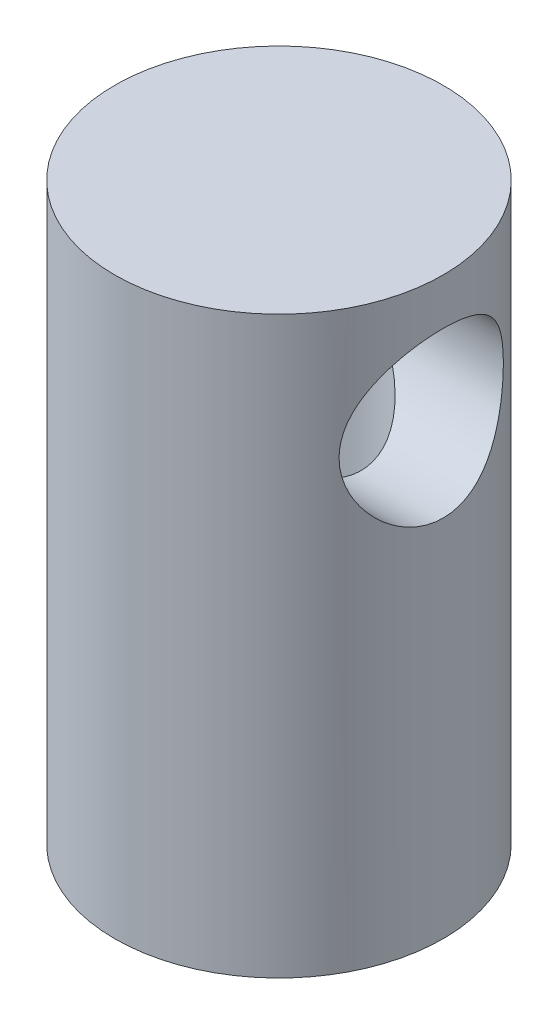
from build123d import *

# Parameters (mm, degrees)
SKETCH_1_R               = 6
EXTRUDE_2_DEPTH          = 21
SKETCH_2_R               = 3
CUT_EXTRUDE_1_DEPTH      = 15
CUT_EXTRUDE_2_DEPTH      = 10
CUT_EXTRUDE_2_DEPTH_BACK = 10
SKETCH_3_R               = 3


with BuildPart() as part:
    # 草图1 → 凸台-拉伸2 (new body)
    with BuildSketch(Plane(origin=(0, 0, 0), x_dir=(1, 0, 0), z_dir=(0, 1, 0))):
        Circle(SKETCH_1_R)
    extrude(amount=EXTRUDE_2_DEPTH)

    # 草图2 → 切除-拉伸1 (cut)
    with BuildSketch(Plane.XZ):
        Circle(SKETCH_2_R)
    extrude(amount=-CUT_EXTRUDE_1_DEPTH, mode=Mode.SUBTRACT)

    # 草图3 → 切除-拉伸2 (cut, two sides: drawn at the far end of the back side and taken through both)
    with BuildSketch(Plane(origin=(0, 0, 0), x_dir=(0, 0, -1), z_dir=(1, 0, 0)).offset(-CUT_EXTRUDE_2_DEPTH_BACK)):
        with Locations((0, 16.309431348)):
            Circle(SKETCH_3_R)
    extrude(amount=CUT_EXTRUDE_2_DEPTH + CUT_EXTRUDE_2_DEPTH_BACK, mode=Mode.SUBTRACT)


solid = part.part
